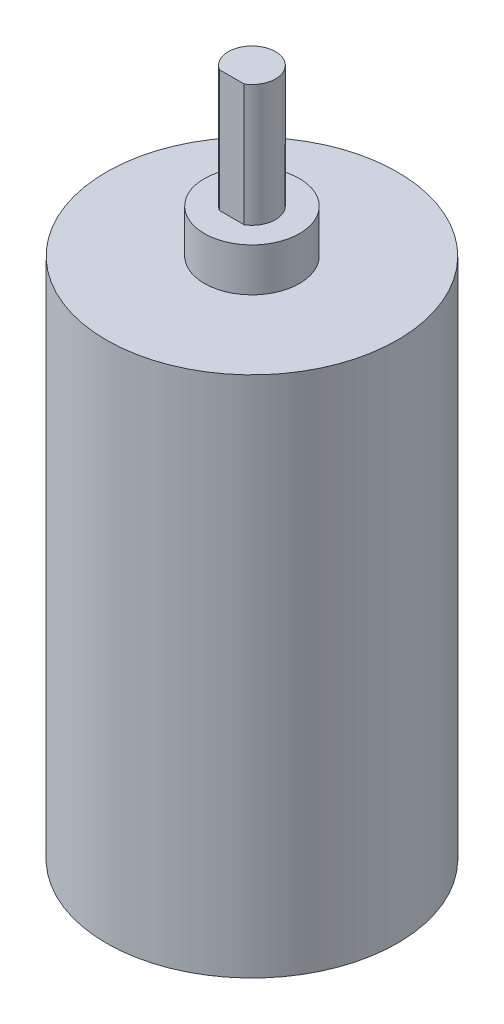
from build123d import *

# Parameters (mm, degrees)
SKETCH1_R           = 185
BOSS_EXTRUDE1_DEPTH = 664
SKETCH2_R           = 60.5
BOSS_EXTRUDE2_DEPTH = 55
BOSS_EXTRUDE3_DEPTH = 155
SCALE1_SCALE        = 0.1


with BuildPart() as part:
    # Sketch1 → Boss-Extrude1 (new body)
    with BuildSketch(Plane(origin=(0, 0, 0), x_dir=(1, 0, 0), z_dir=(0, 1, 0))):
        with Locations(Location((0, 0, 0), (0, 0, 270))):
            Circle(SKETCH1_R)
    extrude(amount=BOSS_EXTRUDE1_DEPTH)

    # Sketch2 → Boss-Extrude2 (add)
    with BuildSketch(Plane(origin=(0, 664, 0), x_dir=(1, 0, 0), z_dir=(0, 1, 0))):
        with Locations(Location((0, 0, 0), (0, 0, 270))):
            Circle(SKETCH2_R)
    extrude(amount=BOSS_EXTRUDE2_DEPTH)

    # Sketch3 → Boss-Extrude3 (add)
    with BuildSketch(Plane(origin=(0, 719, 0), x_dir=(1, 0, 0), z_dir=(0, 1, 0))):
        with BuildLine():
            Line((0, -25.564167514), (15.699469395, -25.564167514))
            ThreePointArc((15.699469395, -25.564167514), (0, 30), (-15.699469395, -25.564167514))
            Line((-15.699469395, -25.564167514), (0, -25.564167514))
        make_face()
    extrude(amount=BOSS_EXTRUDE3_DEPTH)


with BuildPart() as part_1:
    # Scale1: scaled about (0, 337.854264359, -0.005518954)
    add(part.part.scale(SCALE1_SCALE).moved(Location((0, 304.068837923, -0.004967059))))


solid = part_1.part
